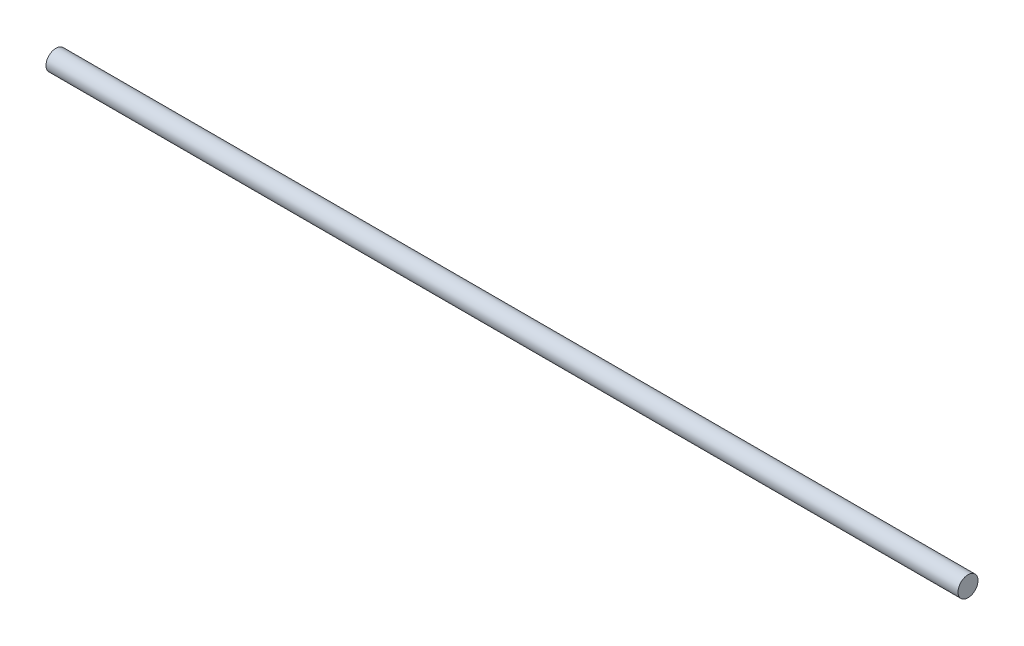
from build123d import *

# Parameters (mm, degrees)
CROQUIS1_R              = 2.5
SALIENTE_EXTRUIR1_DEPTH = 228


with BuildPart() as part:
    # Croquis1 → Saliente-Extruir1 (new body)
    with BuildSketch(Plane(origin=(0, 0, 0), x_dir=(0, 0, -1), z_dir=(1, 0, 0))):
        with Locations(Location((0, 0, 0), (0, 0, 180))):
            Circle(CROQUIS1_R)
    extrude(amount=SALIENTE_EXTRUIR1_DEPTH)


solid = part.part
